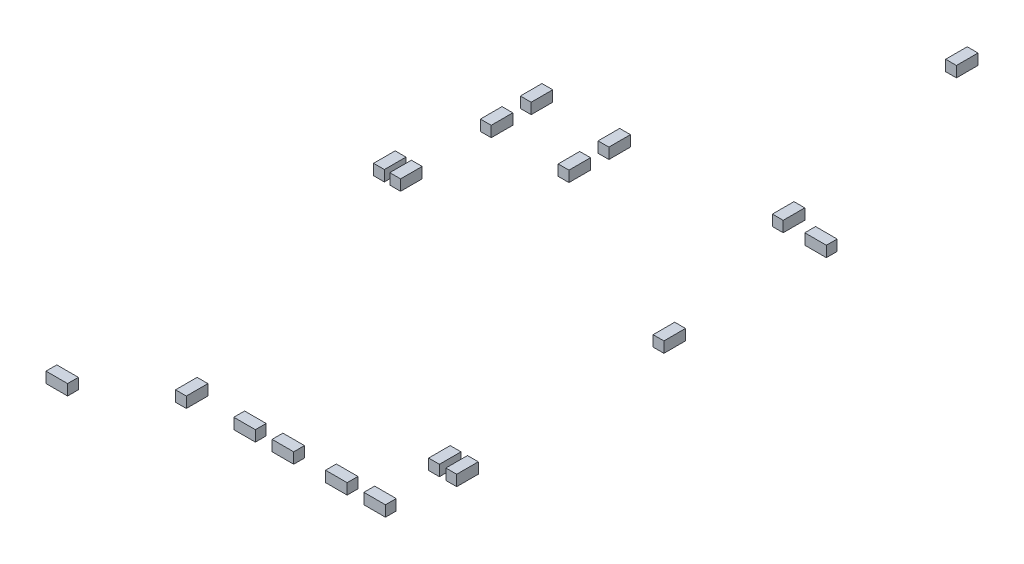
from build123d import *

# Parameters (mm, degrees)
SKETCH2_W              = 1.016
SKETCH2_H              = 0.508
BOSS_EXTRUDE1_DEPTH    = 0.508
BOSS_EXTRUDE1_2_DEPTH  = 0.508
BOSS_EXTRUDE1_3_DEPTH  = 0.508
BOSS_EXTRUDE1_4_DEPTH  = 0.508
SKETCH2_W_2            = 0.508
SKETCH2_H_2            = 1.016
BOSS_EXTRUDE1_5_DEPTH  = 0.508
BOSS_EXTRUDE1_6_DEPTH  = 0.508
BOSS_EXTRUDE1_7_DEPTH  = 0.508
BOSS_EXTRUDE1_8_DEPTH  = 0.508
BOSS_EXTRUDE1_9_DEPTH  = 0.508
BOSS_EXTRUDE1_10_DEPTH = 0.508
BOSS_EXTRUDE1_11_DEPTH = 0.508
BOSS_EXTRUDE1_12_DEPTH = 0.508
BOSS_EXTRUDE1_13_DEPTH = 0.508
BOSS_EXTRUDE1_14_DEPTH = 0.508
BOSS_EXTRUDE1_15_DEPTH = 0.508
BOSS_EXTRUDE1_16_DEPTH = 0.508
BOSS_EXTRUDE1_17_DEPTH = 0.508
BOSS_EXTRUDE1_18_DEPTH = 0.508


with BuildPart() as part:
    # Sketch2 → Boss-Extrude1 (new body)
    with BuildSketch(Plane(origin=(0, 0, 0), x_dir=(1, 0, 0), z_dir=(0, 1, 0))):
        with Locations((6.3754, -8.509)):
            Rectangle(SKETCH2_W, SKETCH2_H)
    extrude(amount=BOSS_EXTRUDE1_DEPTH)


with BuildPart() as body_2:
    # Sketch2 → Boss-Extrude1 2 (new body)
    with BuildSketch(Plane(origin=(0, 0, 0), x_dir=(1, 0, 0), z_dir=(0, 1, 0))):
        with Locations((4.572, -8.509)):
            Rectangle(SKETCH2_W, SKETCH2_H)
    extrude(amount=BOSS_EXTRUDE1_2_DEPTH)


with BuildPart() as body_3:
    # Sketch2 → Boss-Extrude1 3 (new body)
    with BuildSketch(Plane(origin=(0, 0, 0), x_dir=(1, 0, 0), z_dir=(0, 1, 0))):
        with Locations((2.0574, -8.509)):
            Rectangle(SKETCH2_W, SKETCH2_H)
    extrude(amount=BOSS_EXTRUDE1_3_DEPTH)


with BuildPart() as body_4:
    # Sketch2 → Boss-Extrude1 4 (new body)
    with BuildSketch(Plane(origin=(0, 0, 0), x_dir=(1, 0, 0), z_dir=(0, 1, 0))):
        with Locations((0.254, -8.509)):
            Rectangle(SKETCH2_W, SKETCH2_H)
    extrude(amount=BOSS_EXTRUDE1_4_DEPTH)


with BuildPart() as body_5:
    # Sketch2 → Boss-Extrude1 5 (new body)
    with BuildSketch(Plane(origin=(0, 0, 0), x_dir=(1, 0, 0), z_dir=(0, 1, 0))):
        with Locations((-2.4892, -8.509)):
            Rectangle(SKETCH2_W_2, SKETCH2_H_2)
    extrude(amount=BOSS_EXTRUDE1_5_DEPTH)


with BuildPart() as body_6:
    # Sketch2 → Boss-Extrude1 6 (new body)
    with BuildSketch(Plane(origin=(0, 0, 0), x_dir=(1, 0, 0), z_dir=(0, 1, 0))):
        with Locations((-6.0452, -11.049)):
            Rectangle(SKETCH2_W, SKETCH2_H)
    extrude(amount=BOSS_EXTRUDE1_6_DEPTH)


with BuildPart() as body_7:
    # Sketch2 → Boss-Extrude1 7 (new body)
    with BuildSketch(Plane(origin=(0, 0, 0), x_dir=(1, 0, 0), z_dir=(0, 1, 0))):
        with Locations((6.2484, -5.334)):
            Rectangle(SKETCH2_W_2, SKETCH2_H_2)
    extrude(amount=BOSS_EXTRUDE1_7_DEPTH)


with BuildPart() as body_8:
    # Sketch2 → Boss-Extrude1 8 (new body)
    with BuildSketch(Plane(origin=(0, 0, 0), x_dir=(1, 0, 0), z_dir=(0, 1, 0))):
        with Locations((7.0612, -5.334)):
            Rectangle(SKETCH2_W_2, SKETCH2_H_2)
    extrude(amount=BOSS_EXTRUDE1_8_DEPTH)


with BuildPart() as body_9:
    # Sketch2 → Boss-Extrude1 9 (new body)
    with BuildSketch(Plane(origin=(0, 0, 0), x_dir=(1, 0, 0), z_dir=(0, 1, 0))):
        with Locations((6.5024, 4.9784)):
            Rectangle(SKETCH2_W_2, SKETCH2_H_2)
    extrude(amount=BOSS_EXTRUDE1_9_DEPTH)


with BuildPart() as body_10:
    # Sketch2 → Boss-Extrude1 10 (new body)
    with BuildSketch(Plane(origin=(0, 0, 0), x_dir=(1, 0, 0), z_dir=(0, 1, 0))):
        with Locations((-6.2992, 5.3848)):
            Rectangle(SKETCH2_W_2, SKETCH2_H_2)
    extrude(amount=BOSS_EXTRUDE1_10_DEPTH)


with BuildPart() as body_11:
    # Sketch2 → Boss-Extrude1 11 (new body)
    with BuildSketch(Plane(origin=(0, 0, 0), x_dir=(1, 0, 0), z_dir=(0, 1, 0))):
        with Locations((-7.0612, 5.3848)):
            Rectangle(SKETCH2_W_2, SKETCH2_H_2)
    extrude(amount=BOSS_EXTRUDE1_11_DEPTH)


with BuildPart() as body_12:
    # Sketch2 → Boss-Extrude1 12 (new body)
    with BuildSketch(Plane(origin=(0, 0, 0), x_dir=(1, 0, 0), z_dir=(0, 1, 0))):
        with Locations((-6.35, 9.7028)):
            Rectangle(SKETCH2_W_2, SKETCH2_H_2)
    extrude(amount=BOSS_EXTRUDE1_12_DEPTH)


with BuildPart() as body_13:
    # Sketch2 → Boss-Extrude1 13 (new body)
    with BuildSketch(Plane(origin=(0, 0, 0), x_dir=(1, 0, 0), z_dir=(0, 1, 0))):
        with Locations((-6.35, 11.5824)):
            Rectangle(SKETCH2_W_2, SKETCH2_H_2)
    extrude(amount=BOSS_EXTRUDE1_13_DEPTH)


with BuildPart() as body_14:
    # Sketch2 → Boss-Extrude1 14 (new body)
    with BuildSketch(Plane(origin=(0, 0, 0), x_dir=(1, 0, 0), z_dir=(0, 1, 0))):
        with Locations((-2.6924, 11.5824)):
            Rectangle(SKETCH2_W_2, SKETCH2_H_2)
    extrude(amount=BOSS_EXTRUDE1_14_DEPTH)


with BuildPart() as body_15:
    # Sketch2 → Boss-Extrude1 15 (new body)
    with BuildSketch(Plane(origin=(0, 0, 0), x_dir=(1, 0, 0), z_dir=(0, 1, 0))):
        with Locations((-2.6924, 9.7028)):
            Rectangle(SKETCH2_W_2, SKETCH2_H_2)
    extrude(amount=BOSS_EXTRUDE1_15_DEPTH)


with BuildPart() as body_16:
    # Sketch2 → Boss-Extrude1 16 (new body)
    with BuildSketch(Plane(origin=(0, 0, 0), x_dir=(1, 0, 0), z_dir=(0, 1, 0))):
        with Locations((6.1722, 12.446)):
            Rectangle(SKETCH2_W, SKETCH2_H)
    extrude(amount=BOSS_EXTRUDE1_16_DEPTH)


with BuildPart() as body_17:
    # Sketch2 → Boss-Extrude1 17 (new body)
    with BuildSketch(Plane(origin=(0, 0, 0), x_dir=(1, 0, 0), z_dir=(0, 1, 0))):
        with Locations((4.3942, 12.7)):
            Rectangle(SKETCH2_W_2, SKETCH2_H_2)
    extrude(amount=BOSS_EXTRUDE1_17_DEPTH)


with BuildPart() as body_18:
    # Sketch2 → Boss-Extrude1 18 (new body)
    with BuildSketch(Plane(origin=(0, 0, 0), x_dir=(1, 0, 0), z_dir=(0, 1, 0))):
        with Locations((2.159, 23.0886)):
            Rectangle(SKETCH2_W_2, SKETCH2_H_2)
    extrude(amount=BOSS_EXTRUDE1_18_DEPTH)


solid = Compound([part.part, body_2.part, body_3.part, body_4.part, body_5.part, body_6.part, body_7.part, body_8.part, body_9.part, body_10.part, body_11.part, body_12.part, body_13.part, body_14.part, body_15.part, body_16.part, body_17.part, body_18.part])
